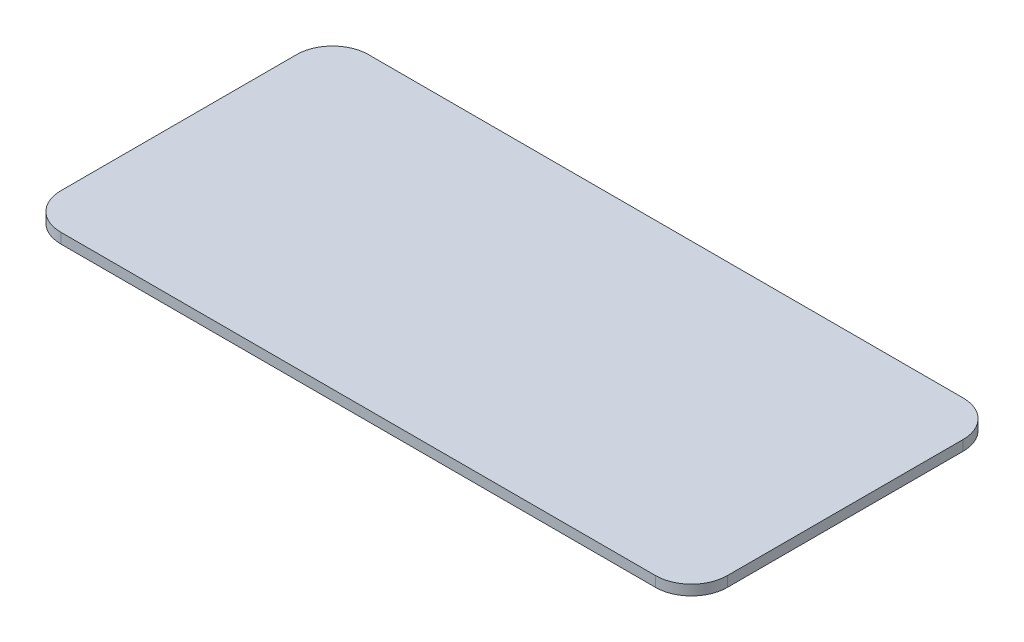
from build123d import *

# Parameters (mm, degrees)
BOSS_EXTRUDE1_DEPTH = 1


with BuildPart() as part:
    # Sketch1 → Boss-Extrude1 (new body)
    with BuildSketch(Plane(origin=(0, 0, 0), x_dir=(1, 0, 0), z_dir=(0, 1, 0))):
        with BuildLine():
            Line((-25.523592901, 29.495579807), (32.476407099, 29.495579807))
            ThreePointArc((32.476407099, 29.495579807), (34.951280833, 28.470453541), (35.976407099, 25.995579807))
            Line((35.976407099, 25.995579807), (35.976407099, 2.995579807))
            ThreePointArc((35.976407099, 2.995579807), (34.951280833, 0.520706073), (32.476407099, -0.504420193))
            Line((32.476407099, -0.504420193), (-25.523592901, -0.504420193))
            ThreePointArc((-25.523592901, -0.504420193), (-27.998466635, 0.520706073), (-29.023592901, 2.995579807))
            Line((-29.023592901, 2.995579807), (-29.023592901, 25.995579807))
            ThreePointArc((-29.023592901, 25.995579807), (-27.998466635, 28.470453541), (-25.523592901, 29.495579807))
        make_face()
    extrude(amount=BOSS_EXTRUDE1_DEPTH)


solid = part.part
